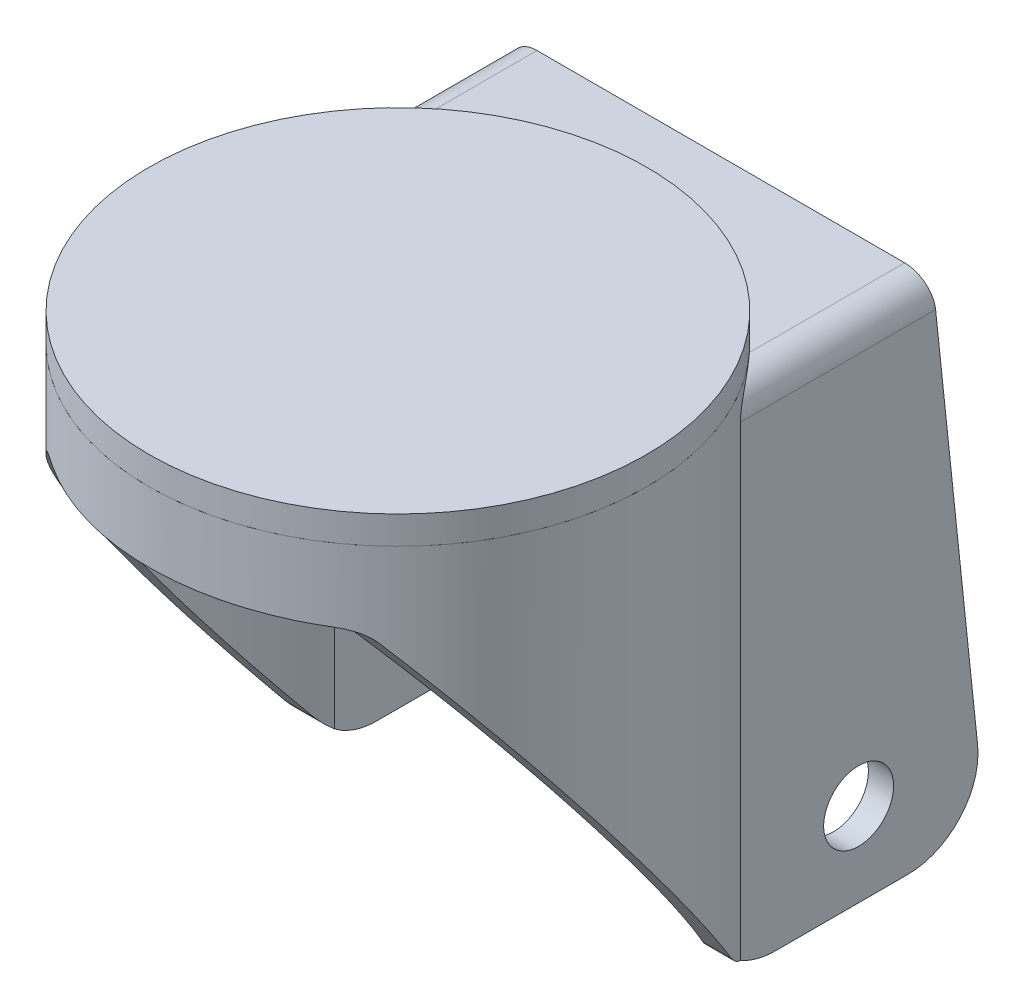
from build123d import *

# Parameters (mm, degrees)
SKETCH1_R           = 17.8
BOSS_EXTRUDE1_DEPTH = 2
BOSS_EXTRUDE2_DEPTH = 36
SKETCH3_W           = 26.7
SKETCH3_H           = 1.8
CUT_EXTRUDE1_DEPTH  = 34.2
CUT_EXTRUDE2_DEPTH  = 57.964638154
BOSS_EXTRUDE3_DEPTH = 30.3
SKETCH6_W           = 26.7
SKETCH6_H           = 3.8
CUT_EXTRUDE3_DEPTH  = 34.2
CUT_EXTRUDE4_REACH  = 59.038
SKETCH7_R           = 2.5
FILLET1_R           = 2
FILLET2_R           = 5
FILLET3_R           = 5


with BuildPart() as part:
    # Sketch1 → Boss-Extrude1 (new body)
    with BuildSketch(Plane(origin=(0, 0, 0), x_dir=(1, 0, 0), z_dir=(0, 1, 0))):
        with Locations(Location((0, 0, 0), (0, 0, 270))):
            Circle(SKETCH1_R)
    extrude(amount=-BOSS_EXTRUDE1_DEPTH)


with BuildPart() as body_2:
    # Sketch2 → Boss-Extrude2 (new body)
    with BuildSketch(Plane.XZ.offset(2)):
        with BuildLine():
            ThreePointArc((17.8, 0), (17.124689778, 4.856439025), (15.15, 9.34438334))
            Line((15.15, 9.34438334), (15.15, -9.34438334))
            ThreePointArc((15.15, -9.34438334), (17.124689778, -4.856439025), (17.8, 0))
        make_face()
        with BuildLine():
            ThreePointArc((15.15, 9.34438334), (0, 17.8), (-15.15, 9.34438334))
            Line((-15.15, 9.34438334), (-15.15, -9.34438334))
            ThreePointArc((-15.15, -9.34438334), (0, -17.8), (15.15, -9.34438334))
            Line((15.15, -9.34438334), (15.15, 9.34438334))
        make_face()
        with BuildLine():
            ThreePointArc((15.15, -9.34438334), (0, -17.8), (-15.15, -9.34438334))
            Line((-15.15, -9.34438334), (-15.15, -23.1))
            Line((-15.15, -23.1), (15.15, -23.1))
            Line((15.15, -23.1), (15.15, -9.34438334))
        make_face()
        with BuildLine():
            Line((-15.15, -9.34438334), (-15.15, 9.34438334))
            ThreePointArc((-15.15, 9.34438334), (-17.8, 0), (-15.15, -9.34438334))
        make_face()
    extrude(amount=BOSS_EXTRUDE2_DEPTH)

    # Sketch3 → Cut-Extrude1 (cut)
    with BuildSketch(Plane.XZ.offset(38)):
        with BuildLine():
            Line((13.35, -21.3), (13.35, -8.819155288))
            ThreePointArc((13.35, -8.819155288), (0, 16), (-13.35, -8.819155288))
            Line((-13.35, -8.819155288), (-13.35, -21.3))
            Line((-13.35, -21.3), (13.35, -21.3))
        make_face()
        with Locations((0, -22.2)):
            Rectangle(SKETCH3_W, SKETCH3_H)
    extrude(amount=-CUT_EXTRUDE1_DEPTH, mode=Mode.SUBTRACT)

    # Sketch4 → Cut-Extrude2 (cut, through all)
    with BuildSketch(Plane(origin=(17.8, 0, 0), x_dir=(0, 0, -1), z_dir=(1, 0, 0))):
        Polygon((-17.8, -7), (-17.8, -38), (9.34438334, -38), (-13.809389095, -7.27390619), align=None)
    extrude(amount=-CUT_EXTRUDE2_DEPTH, mode=Mode.SUBTRACT)

    # Sketch5 → Boss-Extrude3 (add)
    with BuildSketch(Plane(origin=(15.15, 0, 0), x_dir=(0, 0, -1), z_dir=(1, 0, 0))):
        Polygon((23.1, -2), (26.9, -38), (23.1, -38), align=None)
    extrude(amount=-BOSS_EXTRUDE3_DEPTH)

    # Sketch6 → Cut-Extrude3 (cut)
    with BuildSketch(Plane.XZ.offset(38)):
        with Locations((0, -25)):
            Rectangle(SKETCH6_W, SKETCH6_H)
    extrude(amount=-CUT_EXTRUDE3_DEPTH, mode=Mode.SUBTRACT)

    # Cut-Extrude4: up to this face of the body (flat: up to its plane)
    cut_extrude4_end = Plane(body_2.part.faces().sort_by_distance((-15.15, -20.728173169, -17.210623032))[0])
    # Sketch7 → Cut-Extrude4 (cut, up to the picked face)
    with BuildSketch(Plane(origin=(15.15, 0, 0), x_dir=(0, 0, -1), z_dir=(1, 0, 0)), mode=Mode.PRIVATE) as cut_extrude4_sk1:
        with Locations((17.805525003, -32)):
            Circle(SKETCH7_R)
    cut_extrude4_tool1 = split(extrude(cut_extrude4_sk1.sketch, amount=-CUT_EXTRUDE4_REACH, mode=Mode.PRIVATE), bisect_by=cut_extrude4_end, keep=Keep.BOTH, mode=Mode.PRIVATE)
    add(cut_extrude4_tool1.solids().sort_by(Axis((15.15, -32, -17.805525), (-1, 0, 0)))[0], mode=Mode.SUBTRACT)

    # Fillet1
    fillet1_edges = [body_2.edges().sort_by_distance(p)[0] for p in [
        (-9.656065145, -7.27390619, 13.809389095),
        (9.656065145, -7.27390619, 13.809389095),
        (-15.15, -2, -16.22219167),
        (15.15, -2, -16.22219167),
    ]]
    fillet(fillet1_edges, radius=FILLET1_R)

    # Fillet2
    fillet2_edges = [body_2.edges().sort_by_distance(p)[0] for p in [
        (-14.25, -38, -26.9),
        (14.25, -38, -26.9),
    ]]
    fillet(fillet2_edges, radius=FILLET2_R)

    # Fillet3
    fillet3_edges = [body_2.edges().sort_by_distance(p)[0] for p in [
        (14.25, -38, -9.34438334),
        (-14.25, -38, -9.34438334),
    ]]
    fillet(fillet3_edges, radius=FILLET3_R)


solid = Compound([part.part, body_2.part])
